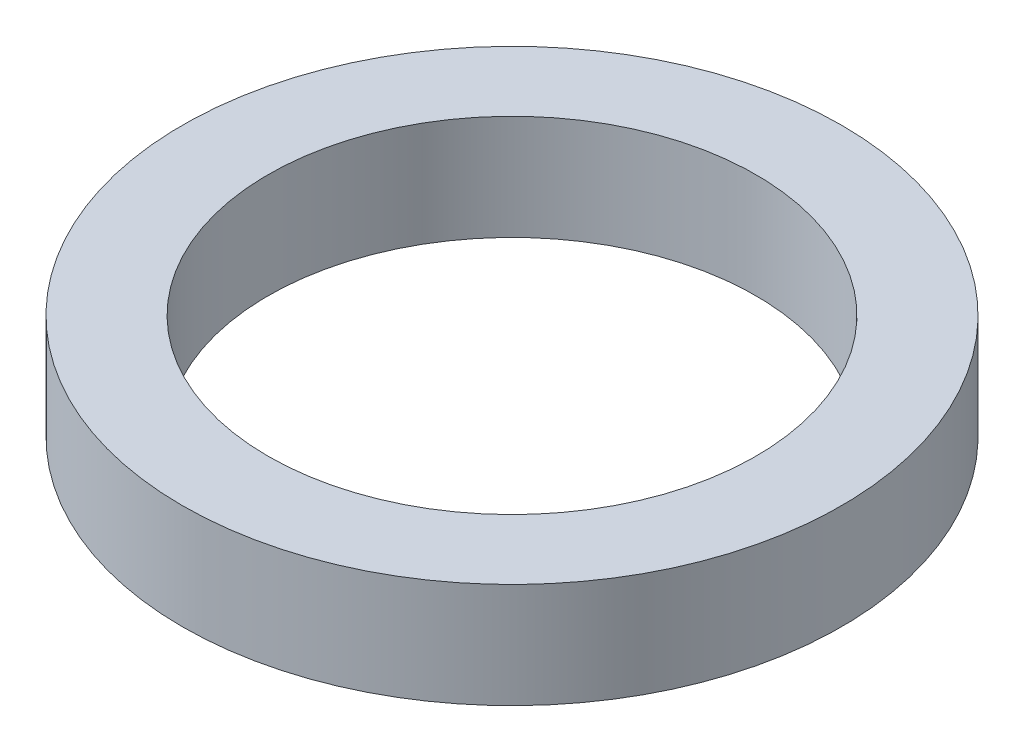
from build123d import *

# Parameters (mm, degrees)
IZIM1_R                     = 17.24
Y_KSEKLIK_EKSTR_ZYON1_DEPTH = 5.49
KES_EKSTR_ZYON1_DEPTH       = 7
KES_EKSTR_ZYON1_DEPTH_BACK  = 8.49
IZIM2_R                     = 12.76


with BuildPart() as part:
    # Çizim1 → Yükseklik-Ekstrüzyon1 (new body)
    with BuildSketch(Plane(origin=(0, 0, 0), x_dir=(1, 0, 0), z_dir=(0, 1, 0))):
        with Locations(Location((0, 0, 0), (0, 0, 270))):
            Circle(IZIM1_R)
    extrude(amount=Y_KSEKLIK_EKSTR_ZYON1_DEPTH)

    # Çizim2 → Kes-Ekstrüzyon1 (cut, two sides: drawn at the far end of the back side and taken through both)
    with BuildSketch(Plane(origin=(0, 5.49, 0), x_dir=(1, 0, 0), z_dir=(0, 1, 0)).offset(-KES_EKSTR_ZYON1_DEPTH_BACK)):
        with Locations(Location((0, 0, 0), (0, 0, 270))):
            Circle(IZIM2_R)
    extrude(amount=KES_EKSTR_ZYON1_DEPTH + KES_EKSTR_ZYON1_DEPTH_BACK, mode=Mode.SUBTRACT)


solid = part.part
